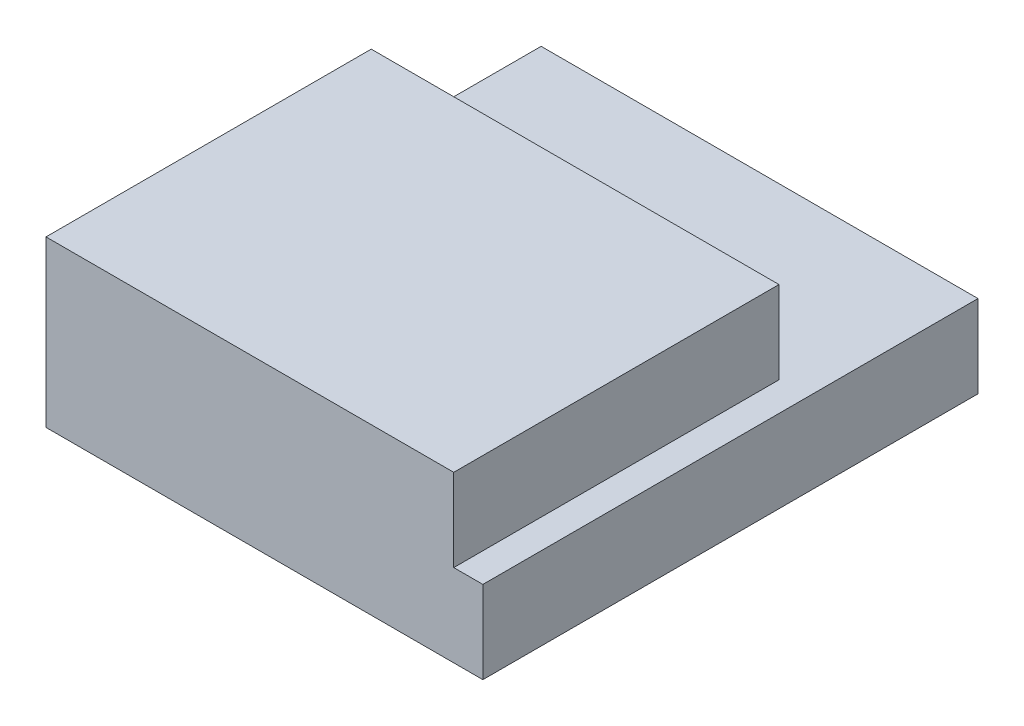
from build123d import *

# Parameters (mm, degrees)
SKETCH2_W           = 90
SKETCH2_H           = 102
BOSS_EXTRUDE2_DEPTH = 17
SKETCH3_W           = 84
SKETCH3_H           = 67
BOSS_EXTRUDE3_DEPTH = 17


with BuildPart() as part:
    # Sketch2 → Boss-Extrude2 (new body)
    with BuildSketch(Plane(origin=(0, 0, 0), x_dir=(1, 0, 0), z_dir=(0, 1, 0))):
        with Locations((28.875, 3.1875)):
            Rectangle(SKETCH2_W, SKETCH2_H)
    extrude(amount=BOSS_EXTRUDE2_DEPTH)

    # Sketch3 → Boss-Extrude3 (add)
    with BuildSketch(Plane(origin=(0, 17, 0), x_dir=(1, 0, 0), z_dir=(0, 1, 0))):
        with Locations((25.875, -14.3125)):
            Rectangle(SKETCH3_W, SKETCH3_H)
    extrude(amount=BOSS_EXTRUDE3_DEPTH)


solid = part.part
